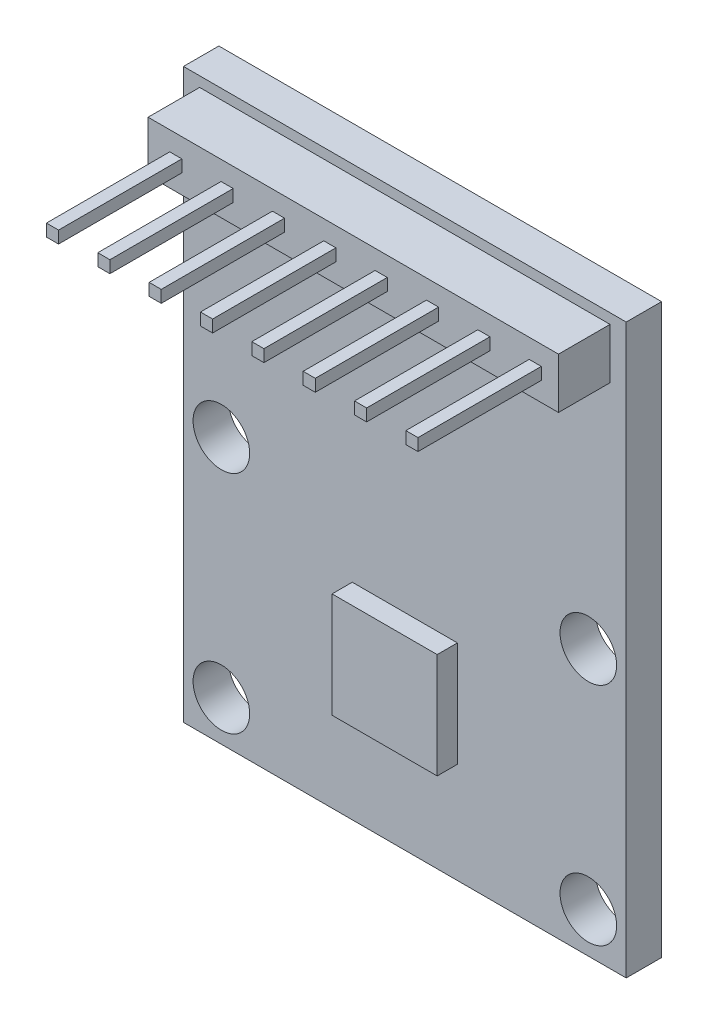
from build123d import *

# Parameters (mm, degrees)
SKETCH1_W           = 21.9
SKETCH1_H           = 28.1
BOSS_EXTRUDE1_DEPTH = 1.75
SKETCH2_R           = 1.4
CUT_EXTRUDE1_DEPTH  = 18.89881281
SKETCH3_W           = 5.2
SKETCH3_H           = 5.2
BOSS_EXTRUDE2_DEPTH = 1
SKETCH4_W           = 20.3
SKETCH4_H           = 2.5
BOSS_EXTRUDE3_DEPTH = 2.55
SKETCH5_W           = 0.6
SKETCH5_H           = 0.6
BOSS_EXTRUDE4_DEPTH = 6.1
LPATTERN1_COUNT     = 8
LPATTERN1_PITCH     = 2.54


with BuildPart() as part:
    # Sketch1 → Boss-Extrude1 (new body)
    with BuildSketch(Plane.XY):
        Rectangle(SKETCH1_W, SKETCH1_H)
    extrude(amount=BOSS_EXTRUDE1_DEPTH)

    # Sketch2 → Cut-Extrude1 (cut, through all)
    with BuildSketch(Plane.XY.offset(1.75)):
        with Locations((-9.075, -0.89)):
            Circle(SKETCH2_R)
        with Locations((9.075, -0.89)):
            Circle(SKETCH2_R)
        with Locations((9.075, -12.05)):
            Circle(SKETCH2_R)
        with Locations((-9.075, -12.05)):
            Circle(SKETCH2_R)
    extrude(amount=-CUT_EXTRUDE1_DEPTH, mode=Mode.SUBTRACT)

    # Sketch3 → Boss-Extrude2 (add)
    with BuildSketch(Plane.XY.offset(1.75)):
        with Locations((0, -6.47)):
            Rectangle(SKETCH3_W, SKETCH3_H)
    extrude(amount=BOSS_EXTRUDE2_DEPTH)

    # Sketch4 → Boss-Extrude3 (add)
    with BuildSketch(Plane.XY.offset(1.75)):
        with Locations((0, 12.3)):
            Rectangle(SKETCH4_W, SKETCH4_H)
    extrude(amount=BOSS_EXTRUDE3_DEPTH)

    # Sketch5 → Boss-Extrude4 (add)
    with BuildSketch(Plane.XY.offset(4.3)):
        with Locations((-8.78, 12.3)):
            Rectangle(SKETCH5_W, SKETCH5_H)
    boss_extrude4 = extrude(amount=BOSS_EXTRUDE4_DEPTH)

    # LPattern1: Boss-Extrude4 ×8
    with Locations(*[(i * LPATTERN1_PITCH, 0, 0) for i in range(1, LPATTERN1_COUNT)]):
        add(boss_extrude4)


solid = part.part
